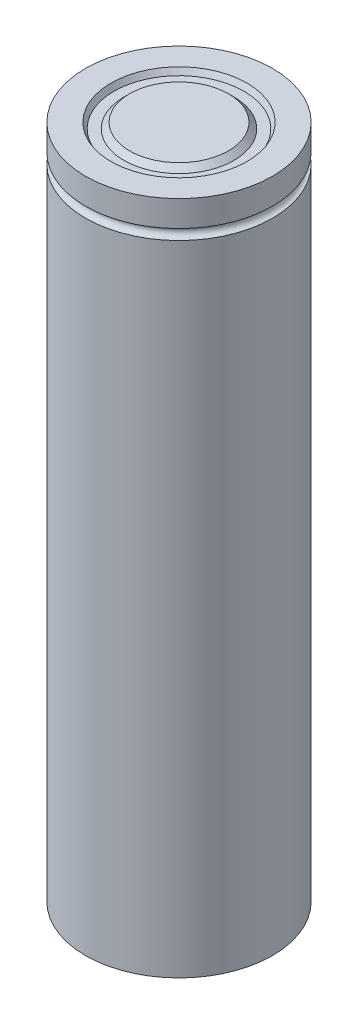
from build123d import *

# Parameters (mm, degrees)
SKETCH1_R           = 9
BOSS_EXTRUDE1_DEPTH = 65
SKETCH2_R           = 0.5


with BuildPart() as part:
    # Sketch1 → Boss-Extrude1 (new body)
    with BuildSketch(Plane(origin=(0, 0, 0), x_dir=(1, 0, 0), z_dir=(0, 1, 0))):
        with Locations(Location((0, 0, 0), (0, 0, 270))):
            Circle(SKETCH1_R)
    extrude(amount=BOSS_EXTRUDE1_DEPTH)

    # Sketch2 → Cut-Revolve1 (revolve, cut)
    with BuildSketch(Plane(origin=(0, 0, 0), x_dir=(0, 0, -1), z_dir=(1, 0, 0))):
        with Locations((9, 62)):
            Circle(SKETCH2_R)
        Polygon((6.548746469, 65), (6.255894625, 64.46676314), (5.297470411, 64.46676314), (4.76423355, 65), align=None)
    revolve(axis=Axis((0, 0, 0), (0, 1, 0)), mode=Mode.SUBTRACT)


solid = part.part
